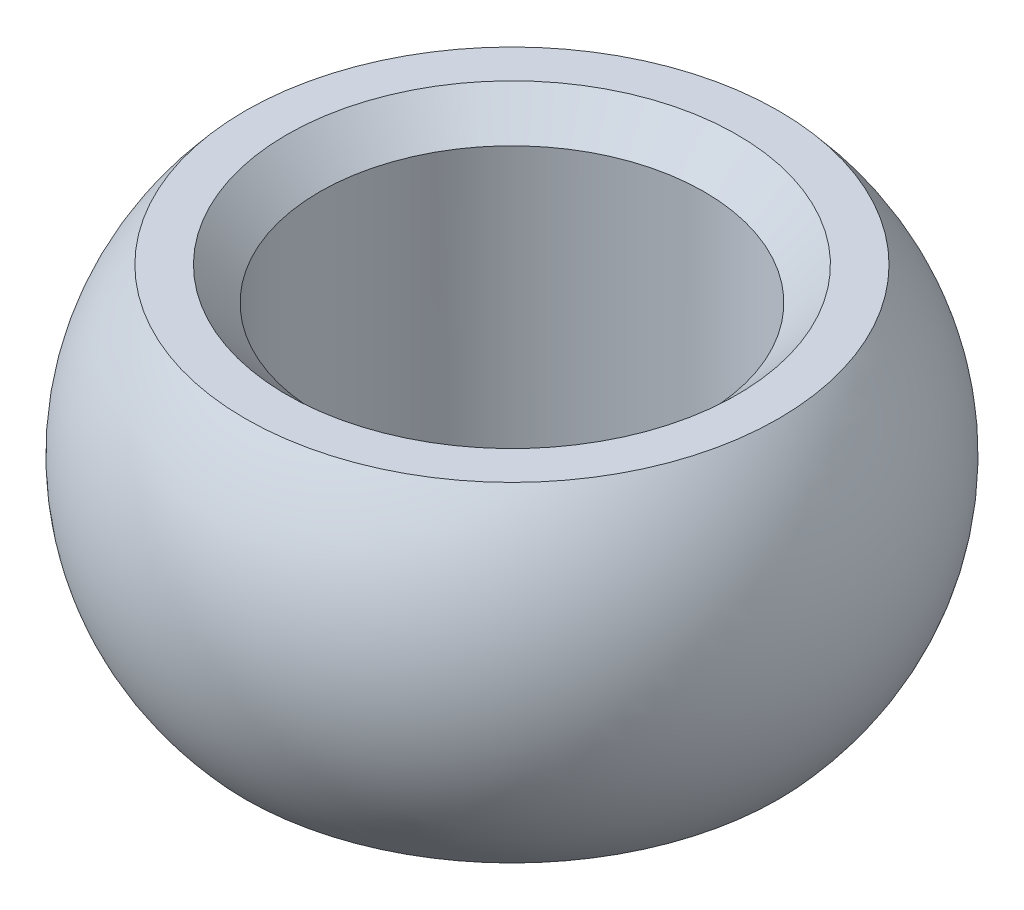
from build123d import *

# Parameters (mm, degrees)
CHAMFER1_SIZE = 3


with BuildPart() as part:
    # Sketch1 → Revolve1 (revolve)
    with BuildSketch(Plane.XY):
        with BuildLine():
            Line((17.5, 15), (24.270509831, 15))
            ThreePointArc((24.270509831, 15), (30, 0), (24.270509831, -15))
            Line((24.270509831, -15), (17.5, -15))
            Line((17.5, -15), (17.5, 15))
        make_face()
    revolve(axis=Axis((0, -441.214999731, 0), (0, 1, 0)))

    # Chamfer1
    chamfer1_edges = [part.edges().sort_by_distance(p)[0] for p in [
        (-17.5, -15, 0),
        (-17.5, 15, 0),
    ]]
    chamfer(chamfer1_edges, length=CHAMFER1_SIZE)


solid = part.part
